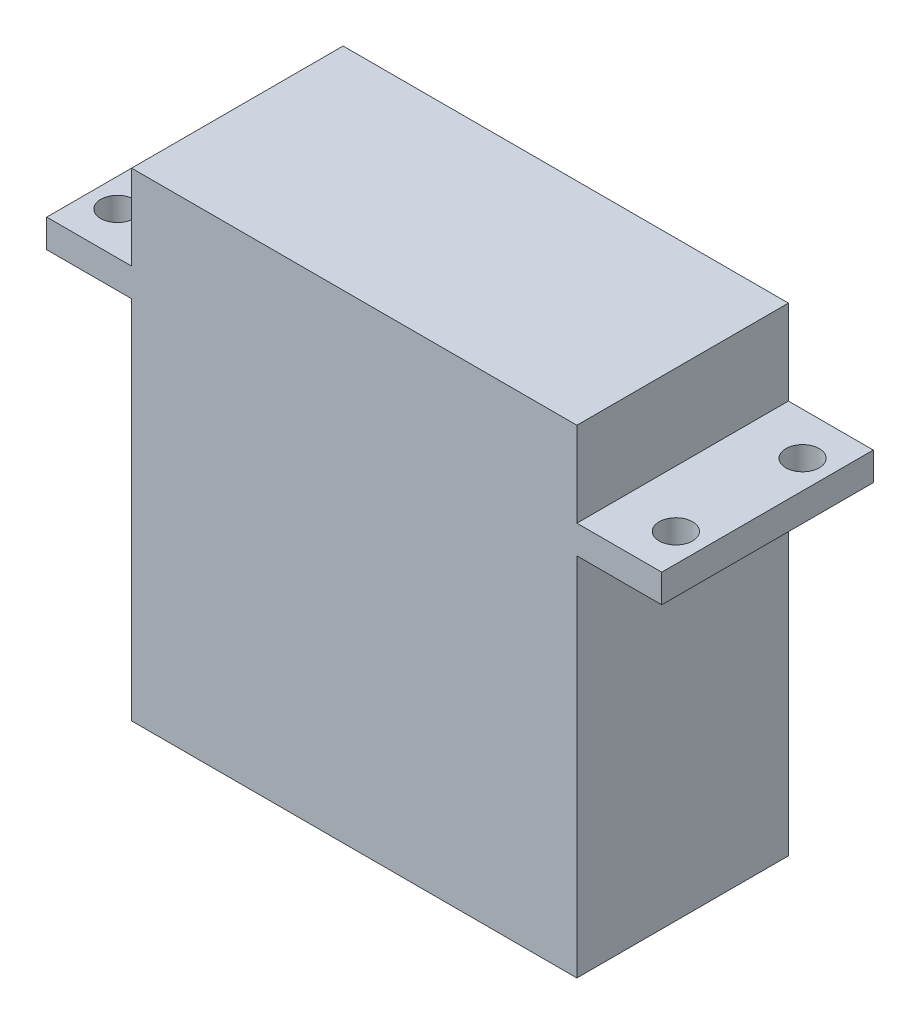
from build123d import *

# Parameters (mm, degrees)
SKETCH1_W           = 40
SKETCH1_H           = 43
BOSS_EXTRUDE1_DEPTH = 19
SKETCH2_W           = 19
SKETCH2_H           = 2.54
BOSS_EXTRUDE2_DEPTH = 7.62
SKETCH3_R           = 1.5
CUT_EXTRUDE1_DEPTH  = 63.292927367
SKETCH4_W           = 19
SKETCH4_H           = 2.54
BOSS_EXTRUDE3_DEPTH = 7.62
SKETCH5_R           = 1.5
CUT_EXTRUDE2_DEPTH  = 63.292927367


with BuildPart() as part:
    # Sketch1 → Boss-Extrude1 (new body)
    with BuildSketch(Plane.XY):
        with Locations((20, 21.5)):
            Rectangle(SKETCH1_W, SKETCH1_H)
    extrude(amount=BOSS_EXTRUDE1_DEPTH)

    # Sketch2 → Boss-Extrude2 (add)
    with BuildSketch(Plane(origin=(40, 0, 0), x_dir=(0, 0, -1), z_dir=(1, 0, 0))):
        with Locations((-9.5, 34.11)):
            Rectangle(SKETCH2_W, SKETCH2_H)
    extrude(amount=BOSS_EXTRUDE2_DEPTH)

    # Sketch3 → Cut-Extrude1 (cut, through all)
    with BuildSketch(Plane(origin=(0, 35.38, 0), x_dir=(1, 0, 0), z_dir=(0, 1, 0))):
        with Locations(Location((45.08, -3.81, 0), (0, 0, 270))):
            Circle(SKETCH3_R)
        with Locations(Location((45.08, -15.19, 0), (0, 0, 270))):
            Circle(SKETCH3_R)
    extrude(amount=-CUT_EXTRUDE1_DEPTH, mode=Mode.SUBTRACT)

    # Sketch4 → Boss-Extrude3 (add)
    with BuildSketch(Plane.ZY):
        with Locations((9.5, 34.11)):
            Rectangle(SKETCH4_W, SKETCH4_H)
    extrude(amount=BOSS_EXTRUDE3_DEPTH)

    # Sketch5 → Cut-Extrude2 (cut, through all)
    with BuildSketch(Plane(origin=(0, 35.38, 0), x_dir=(1, 0, 0), z_dir=(0, 1, 0))):
        with Locations(Location((-5.08, -3.81, 0), (0, 0, 270))):
            Circle(SKETCH5_R)
        with Locations(Location((-5.08, -15.19, 0), (0, 0, 270))):
            Circle(SKETCH5_R)
    extrude(amount=-CUT_EXTRUDE2_DEPTH, mode=Mode.SUBTRACT)


solid = part.part
